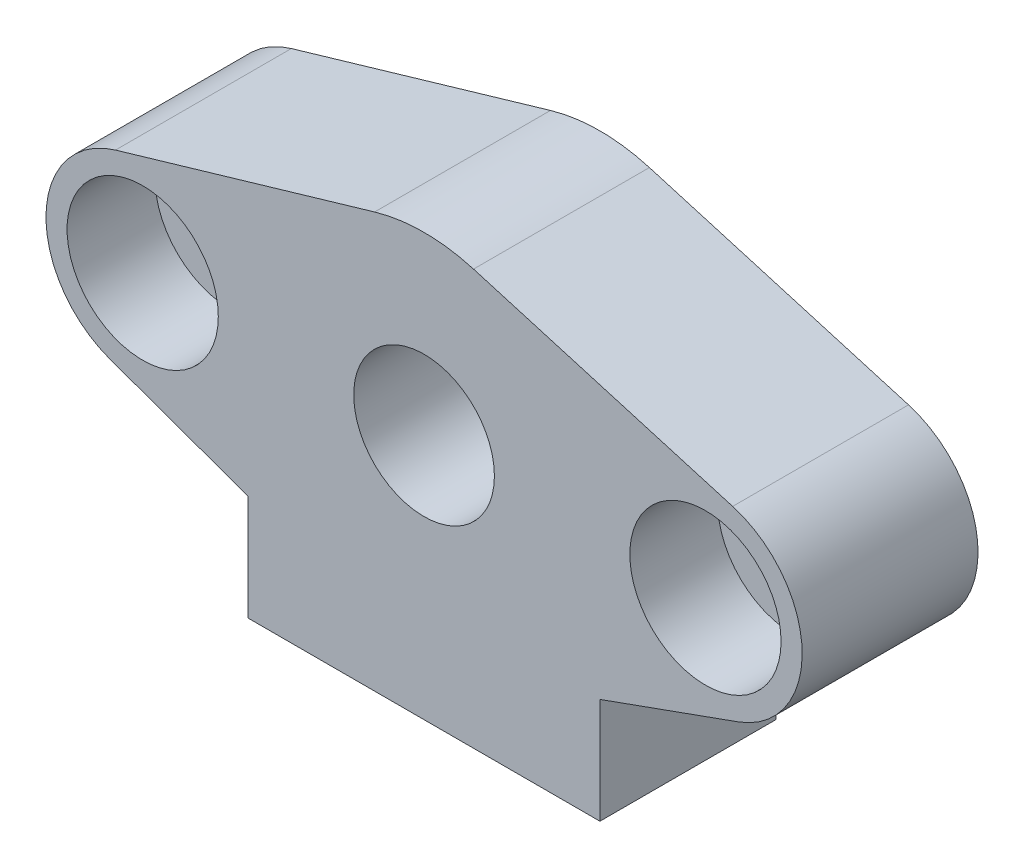
from build123d import *

# Parameters (mm, degrees)
SKETCH_1_R          = 4
SKETCH_1_R_2        = 2.5
EXTRUDE_1_DEPTH     = 10
SKETCH_2_R          = 4.3
CUT_EXTRUDE_1_DEPTH = 5


with BuildPart() as part:
    # 草图1 → 凸台-拉伸1 (new body)
    with BuildSketch(Plane.XY):
        with BuildLine():
            Line((-10, -14), (-10, -8))
            Line((-10, -8), (-17.859724479, -5.17604336))
            ThreePointArc((-17.859724479, -5.17604336), (-21.497538815, 0.16452044), (-17.546875, 5.277989933))
            Line((-17.546875, 5.277989933), (-2.8125, 9.596345333))
            ThreePointArc((-2.8125, 9.596345333), (0, 10), (2.8125, 9.596345333))
            Line((2.8125, 9.596345333), (17.546875, 5.277989933))
            ThreePointArc((17.546875, 5.277989933), (21.497538815, 0.16452044), (17.859724479, -5.17604336))
            Line((17.859724479, -5.17604336), (10, -8))
            Line((10, -8), (10, -14))
            Line((10, -14), (-10, -14))
        make_face()
        Circle(SKETCH_1_R, mode=Mode.SUBTRACT)
        with Locations((-16, 0)):
            Circle(SKETCH_1_R_2, mode=Mode.SUBTRACT)
        with Locations(Location((16, 0, 0), (0, 0, 180))):
            Circle(SKETCH_1_R_2, mode=Mode.SUBTRACT)
    extrude(amount=EXTRUDE_1_DEPTH)

    # 草图2 → 切除-拉伸1 (cut)
    with BuildSketch(Plane.XY.offset(10)):
        with Locations((-16, 0)):
            Circle(SKETCH_2_R)
        with Locations((16, 0)):
            Circle(SKETCH_2_R)
    extrude(amount=-CUT_EXTRUDE_1_DEPTH, mode=Mode.SUBTRACT)


solid = part.part
